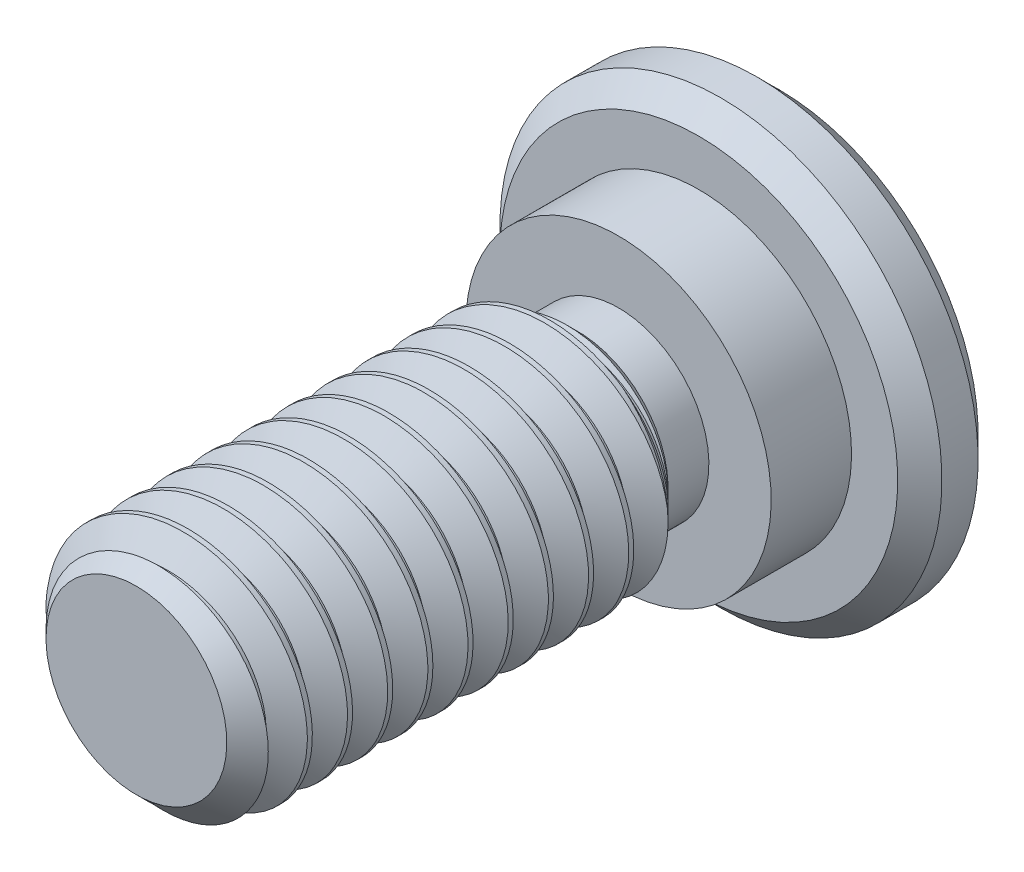
from build123d import *

# Parameters (mm, degrees)
CHAMFER2_SIZE          = 0.375
CUT_EXTRUDE1_DEPTH     = 1.5
CHAMFER1_SIZE          = 0.275
CUT_SWEEP1_PITCH       = 0.5
CUT_SWEEP1_HEIGHT      = 5.9
CUT_SWEEP1_RADIUS      = 1.5
CUT_SWEEP1_START_ANGLE = 90


with BuildPart() as part:
    # Sketch13 → Revolve1 (revolve)
    with BuildSketch(Plane(origin=(0, 0, 0), x_dir=(0, 0, -1), z_dir=(1, 0, 0)), mode=Mode.PRIVATE) as revolve1_sk:
        Polygon((1, 2.75), (0, 2.75), (0, 1.9), (-1, 1.9), (-1, 1.125), (-1.508, 1.125), (-1.883, 1.5), (-7, 1.5), (-7, 0), (1, 0), align=None)
    revolve(revolve1_sk.sketch.rotate(Axis((0, 0, 7), (0, 0, -1)), 180), axis=Axis((0, 0, 7), (0, 0, -1)))

    # Chamfer2
    chamfer2_edges = [part.edges().sort_by_distance(p)[0] for p in [
        (0, 1.5, 7),
    ]]
    chamfer(chamfer2_edges, length=CHAMFER2_SIZE)

    # Sketch7 → Cut-Extrude1 (cut)
    with BuildSketch(Plane(origin=(0, 0, -1), x_dir=(-1, 0, 0), z_dir=(0, 0, -1))):
        Polygon((0, 1.154700538), (-1, 0.577350269), (-1, -0.577350269), (0, -1.154700538), (1, -0.577350269), (1, 0.577350269), align=None)
    extrude(amount=-CUT_EXTRUDE1_DEPTH, mode=Mode.SUBTRACT)

    # Chamfer1
    chamfer1_edges = [part.edges().sort_by_distance(p)[0] for p in [
        (0, 2.75, 0),
        (0, 2.75, -1),
    ]]
    chamfer(chamfer1_edges, length=CHAMFER1_SIZE)

    # Cut-Extrude2 cone 1 section (through the dimple's axis) → Cut-Extrude2 (revolve, cut)
    with BuildSketch(Plane(origin=(0, 0, -1), x_dir=(0, 1, 0), z_dir=(1, 0, 0))):
        Polygon((0, 0), (1.154700538, 0), (0, 1.154700538), align=None)
    revolve(axis=Axis((0, 0, -1), (0, 0, 1)), mode=Mode.SUBTRACT)

    # Cut-Sweep1: sweep along a helix
    with BuildLine() as cut_sweep1_path:
        add(Helix(CUT_SWEEP1_PITCH, CUT_SWEEP1_HEIGHT, CUT_SWEEP1_RADIUS, center=(0, 0, 7), direction=(0, 0, -1), mode=Mode.PRIVATE).rotate(Axis((0, 0, 7), (0, 0, -1)), CUT_SWEEP1_START_ANGLE))
    # Sketch3 → Cut-Sweep1 (sweep, cut)
    with BuildSketch(Plane(origin=(0, 0, 0), x_dir=(0, 0, -1), z_dir=(1, 0, 0))):
        Polygon((-7.453125, 1.527063294), (-6.984375, 1.527063294), (-7.1875, 1.175240474), (-7.25, 1.175240474), align=None)
    sweep(path=cut_sweep1_path.line, is_frenet=True, mode=Mode.SUBTRACT)


solid = part.part
